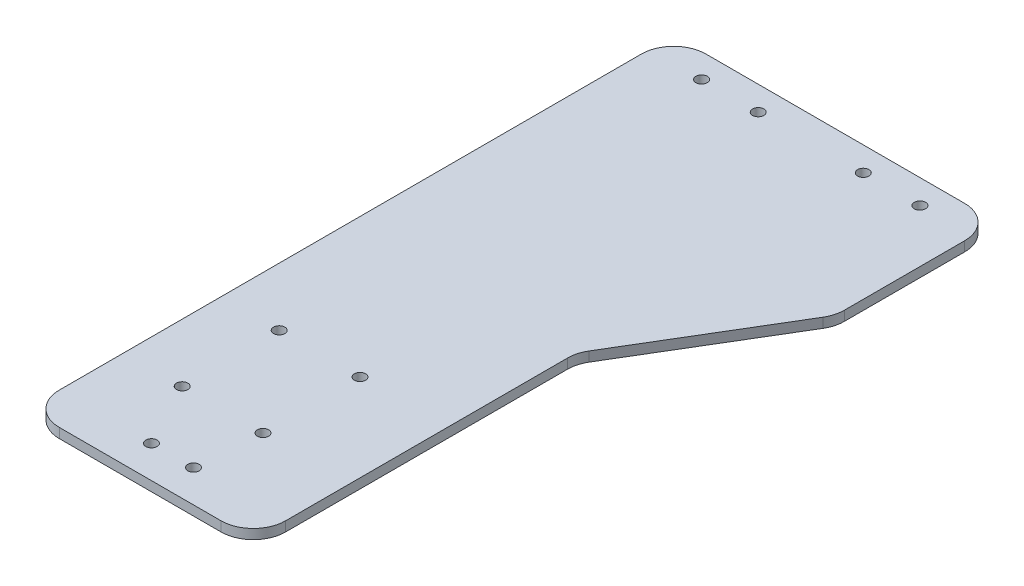
from build123d import *

# Parameters (mm, degrees)
SKETCH_1_W          = 100
SKETCH_1_H          = 200
EXTRUDE_1_DEPTH     = 3
CUT_EXTRUDE_1_DEPTH = 10
FILLET_2_R          = 10
SKETCH_4_R          = 1.75
CUT_EXTRUDE_2_DEPTH = 21
SKETCH_5_R          = 1.75
CUT_EXTRUDE_3_DEPTH = 4
SKETCH_7_R          = 1.75
CUT_EXTRUDE_4_DEPTH = 4


with BuildPart() as part:
    # 草图1 → 凸台-拉伸1 (new body)
    with BuildSketch(Plane(origin=(0, 0, 0), x_dir=(1, 0, 0), z_dir=(0, 1, 0))):
        Rectangle(SKETCH_1_W, SKETCH_1_H)
    extrude(amount=EXTRUDE_1_DEPTH)

    # 草图3 → 切除-拉伸1 (cut)
    with BuildSketch(Plane(origin=(0, 3, 0), x_dir=(1, 0, 0), z_dir=(0, 1, 0))):
        Polygon((20, -100), (20, 0), (50, 50), (50, -100), align=None)
    extrude(amount=-CUT_EXTRUDE_1_DEPTH, mode=Mode.SUBTRACT)

    # 圆角2
    fillet_2_edges = [part.edges().sort_by_distance(p)[0] for p in [
        (20, 1.5, 100),
        (20, 1.5, 0),
        (50, 1.5, -50),
        (-50, 1.5, 100),
        (-50, 1.5, -100),
        (50, 1.5, -100),
    ]]
    fillet(fillet_2_edges, radius=FILLET_2_R)

    # 草图4 → 切除-拉伸2 (cut)
    with BuildSketch(Plane(origin=(0, 3, 0), x_dir=(1, 0, 0), z_dir=(0, 1, 0))):
        with Locations(Location((33.647397187, 92.5, 0), (0, 0, 270))):
            Circle(SKETCH_4_R)
        with Locations(Location((16.132669012, 92.5, 0), (0, 0, 270))):
            Circle(SKETCH_4_R)
        with Locations(Location((-33.867330988, 92.5, 0), (0, 0, 270))):
            Circle(SKETCH_4_R)
        with Locations(Location((-16.352602813, 92.5, 0), (0, 0, 270))):
            Circle(SKETCH_4_R)
    extrude(amount=-CUT_EXTRUDE_2_DEPTH, mode=Mode.SUBTRACT)

    # 草图5 → 切除-拉伸3 (cut)
    with BuildSketch(Plane.XZ):
        with Locations(Location((-8.5, 90, 0), (0, 0, 270))):
            Circle(SKETCH_5_R)
        with Locations(Location((-21.5, 90, 0), (0, 0, 270))):
            Circle(SKETCH_5_R)
    extrude(amount=-CUT_EXTRUDE_3_DEPTH, mode=Mode.SUBTRACT)

    # 草图7 → 切除-拉伸4 (cut)
    with BuildSketch(Plane(origin=(0, 3, 0), x_dir=(1, 0, 0), z_dir=(0, 1, 0))):
        with Locations(Location((-32, -40, 0), (0, 0, 270))):
            Circle(SKETCH_7_R)
        with Locations(Location((-7, -40, 0), (0, 0, 270))):
            Circle(SKETCH_7_R)
        with Locations(Location((-7, -70, 0), (0, 0, 90))):
            Circle(SKETCH_7_R)
        with Locations(Location((-32, -70, 0), (0, 0, 90))):
            Circle(SKETCH_7_R)
    extrude(amount=-CUT_EXTRUDE_4_DEPTH, mode=Mode.SUBTRACT)


solid = part.part
